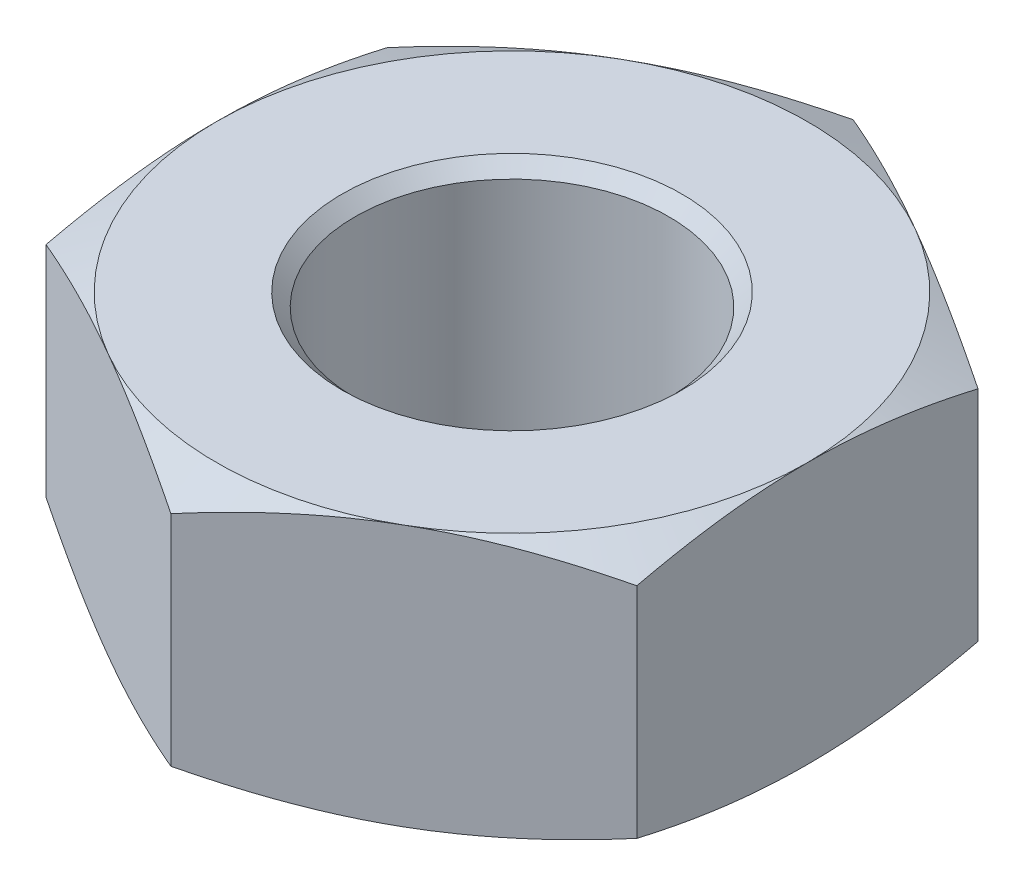
from build123d import *

# Parameters (mm, degrees)
SKETCH1_R           = 1.8
BOSS_EXTRUDE1_DEPTH = 1.5
CHAMFER1_SIZE       = 0.15


with BuildPart() as part:
    # Sketch1 → Boss-Extrude1 (new, symmetric)
    with BuildSketch(Plane(origin=(0, 0, 0), x_dir=(1, 0, 0), z_dir=(0, 1, 0))):
        Polygon((0, 3.914434825), (-3.39, 1.957217413), (-3.39, -1.957217413), (0, -3.914434825), (3.39, -1.957217413), (3.39, 1.957217413), align=None)
        with Locations(Location((0, 0, 0), (0, 0, 270))):
            Circle(SKETCH1_R, mode=Mode.SUBTRACT)
    extrude(amount=BOSS_EXTRUDE1_DEPTH, both=True)

    # Chamfer1
    chamfer1_edges = [part.edges().sort_by_distance(p)[0] for p in [
        (0, -1.5, -1.8),
        (0, 1.5, -1.8),
    ]]
    chamfer(chamfer1_edges, length=CHAMFER1_SIZE)

    # Sketch2 → Cut-Revolve1 (revolve, cut)
    with BuildSketch(Plane.XY):
        Polygon((-3.39, 1.5), (-5, 0.74924467), (-5, 1.5), align=None)
    cut_revolve1 = revolve(axis=Axis((0, 0, 0), (0, 1, 0)), mode=Mode.SUBTRACT)

    # Mirror1: Cut-Revolve1 across plane
    add(cut_revolve1.mirror(Plane.ZX), mode=Mode.SUBTRACT)


solid = part.part
